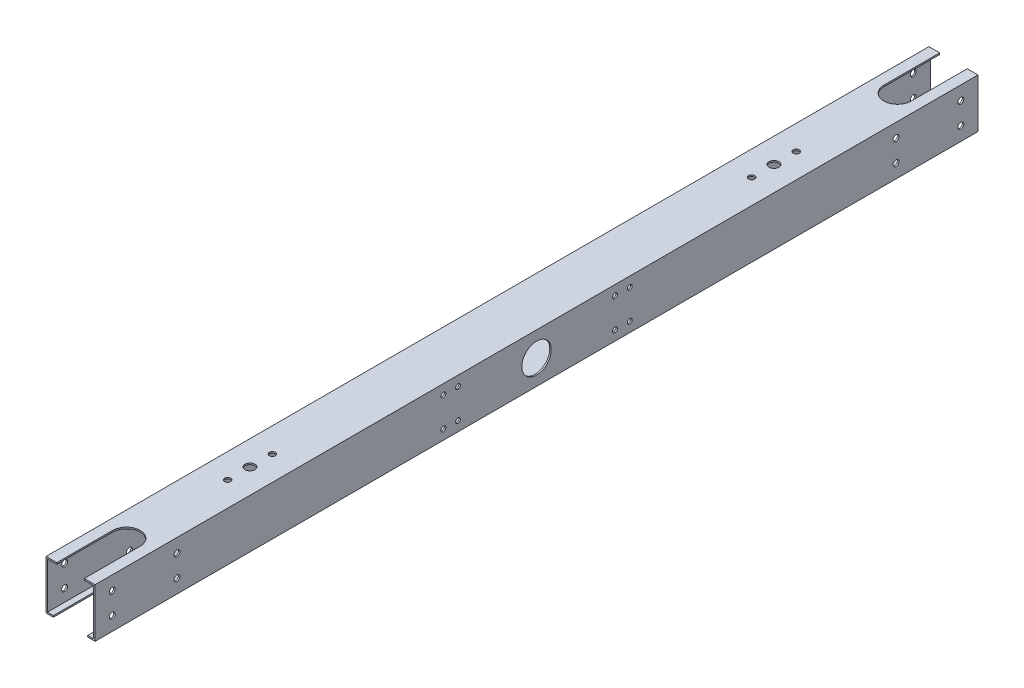
from build123d import *

# Parameters (mm, degrees)
SKETCH1_W           = 50
SKETCH1_H           = 50
SKETCH1_W_2         = 47
SKETCH1_H_2         = 47
BOSS_EXTRUDE1_DEPTH = 900
SKETCH2_R           = 15
CUT_EXTRUDE1_DEPTH  = 59
CUT_EXTRUDE2_DEPTH  = 10
CUT_EXTRUDE3_DEPTH  = 10
SKETCH5_R           = 3
CUT_EXTRUDE4_DEPTH  = 55
SKETCH6_R           = 3.125
SKETCH6_R_2         = 5
CUT_EXTRUDE5_DEPTH  = 70
SKETCH7_R           = 2.5
CUT_EXTRUDE6_DEPTH  = 902.734439844


with BuildPart() as part:
    # Sketch1 → Boss-Extrude1 (new body)
    with BuildSketch(Plane.XY):
        Rectangle(SKETCH1_W, SKETCH1_H)
        Rectangle(SKETCH1_W_2, SKETCH1_H_2, mode=Mode.SUBTRACT)
    extrude(amount=BOSS_EXTRUDE1_DEPTH)

    # Sketch2 → Cut-Extrude1 (cut)
    with BuildSketch(Plane(origin=(25, 0, 0), x_dir=(0, 0, -1), z_dir=(1, 0, 0))):
        with Locations(Location((-450, 0, 0), (0, 0, 90))):
            Circle(SKETCH2_R)
    extrude(amount=-CUT_EXTRUDE1_DEPTH, mode=Mode.SUBTRACT)

    # Sketch3 → Cut-Extrude2 (cut)
    with BuildSketch(Plane(origin=(0, 25, 0), x_dir=(1, 0, 0), z_dir=(0, 1, 0))):
        with BuildLine():
            Line((14, -843), (14, -913.98611775))
            ThreePointArc((14, -913.98611775), (0, -927.98611775), (-14, -913.98611775))
            Line((-14, -913.98611775), (-14, -843))
            ThreePointArc((-14, -843), (0, -829), (14, -843))
        make_face()
    cut_extrude2 = extrude(amount=-CUT_EXTRUDE2_DEPTH, mode=Mode.SUBTRACT)

    # Sketch4 → Cut-Extrude3 (cut)
    with BuildSketch(Plane.XZ.offset(25)):
        with BuildLine():
            Line((-17.498938419, 850), (-17.498938419, 939.078503923))
            ThreePointArc((-17.498938419, 939.078503923), (0.001061581, 956.578503923), (17.501061581, 939.078503923))
            Line((17.501061581, 939.078503923), (17.501061581, 850))
            ThreePointArc((17.501061581, 850), (0.001061581, 832.5), (-17.498938419, 850))
        make_face()
    cut_extrude3 = extrude(amount=-CUT_EXTRUDE3_DEPTH, mode=Mode.SUBTRACT)

    # Sketch5 → Cut-Extrude4 (cut)
    with BuildSketch(Plane(origin=(25, 0, 0), x_dir=(0, 0, -1), z_dir=(1, 0, 0))):
        with Locations(Location((-882.5, 11, 0), (0, 0, 90))):
            Circle(SKETCH5_R)
        with Locations(Location((-882.5, -11, 0), (0, 0, 90))):
            Circle(SKETCH5_R)
        with Locations(Location((-816.5, -11, 0), (0, 0, 90))):
            Circle(SKETCH5_R)
        with Locations(Location((-816.5, 11, 0), (0, 0, 90))):
            Circle(SKETCH5_R)
    cut_extrude4 = extrude(amount=-CUT_EXTRUDE4_DEPTH, mode=Mode.SUBTRACT)

    # Mirror1: Cut-Extrude2, Cut-Extrude3, Cut-Extrude4 across plane
    add(cut_extrude2.mirror(Plane.XY.offset(450)), mode=Mode.SUBTRACT)
    add(cut_extrude3.mirror(Plane.XY.offset(450)), mode=Mode.SUBTRACT)
    add(cut_extrude4.mirror(Plane.XY.offset(450)), mode=Mode.SUBTRACT)

    # Sketch6 → Cut-Extrude5 (cut)
    with BuildSketch(Plane(origin=(0, 25, 0), x_dir=(1, 0, 0), z_dir=(0, 1, 0))):
        with Locations(Location((0, -694.2275, 0), (0, 0, 270))):
            Circle(SKETCH6_R)
        with Locations(Location((0, -739.8525, 0), (0, 0, 270))):
            Circle(SKETCH6_R)
        with Locations(Location((0, -717.04, 0), (0, 0, 270))):
            Circle(SKETCH6_R_2)
    cut_extrude5 = extrude(amount=-CUT_EXTRUDE5_DEPTH, mode=Mode.SUBTRACT)

    # Mirror2: Cut-Extrude5 across plane
    add(cut_extrude5.mirror(Plane.XY.offset(450)), mode=Mode.SUBTRACT)

    # Sketch7 → Cut-Extrude6 (cut, through all)
    with BuildSketch(Plane.ZY.offset(25)):
        with Locations(Location((355, 15, 0), (0, 0, 270))):
            Circle(SKETCH7_R)
        with Locations(Location((370, 15, 0), (0, 0, 90))):
            Circle(SKETCH7_R)
        with Locations(Location((370, -15, 0), (0, 0, 270))):
            Circle(SKETCH7_R)
        with Locations(Location((355, -15, 0), (0, 0, 90))):
            Circle(SKETCH7_R)
        with Locations(Location((545, -15, 0), (0, 0, 270))):
            Circle(SKETCH7_R)
        with Locations(Location((530, -15, 0), (0, 0, 90))):
            Circle(SKETCH7_R)
        with Locations(Location((530, 15, 0), (0, 0, 270))):
            Circle(SKETCH7_R)
        with Locations(Location((545, 15, 0), (0, 0, 90))):
            Circle(SKETCH7_R)
    extrude(amount=-CUT_EXTRUDE6_DEPTH, mode=Mode.SUBTRACT)


solid = part.part
